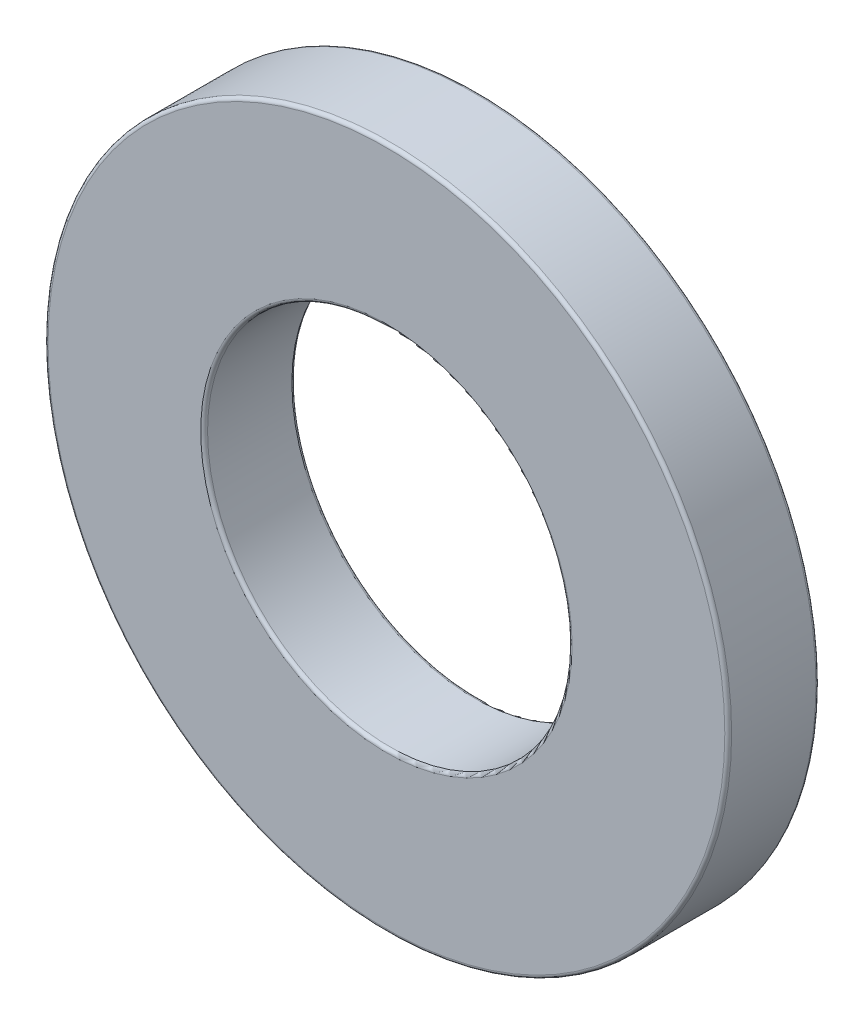
from build123d import *

# Parameters (mm, degrees)
BOSS_EXTRUDE1_START = 0.8
SKETCH3_R           = 6
SKETCH3_R_2         = 3.2
BOSS_EXTRUDE1_DEPTH = 1.6
FILLET1_R           = 0.06


with BuildPart() as part:
    # Sketch3 → Boss-Extrude1 (new body)
    with BuildSketch(Plane.XY.offset(BOSS_EXTRUDE1_START)):
        Circle(SKETCH3_R)
        Circle(SKETCH3_R_2, mode=Mode.SUBTRACT)
    extrude(amount=-BOSS_EXTRUDE1_DEPTH)

    # Fillet1
    fillet1_edges = [part.edges().sort_by_distance(p)[0] for p in [
        (-6, 0, 0.8),
        (-6, 0, -0.8),
        (-3.2, 0, -0.8),
        (-3.2, 0, 0.8),
    ]]
    fillet(fillet1_edges, radius=FILLET1_R)


solid = part.part
